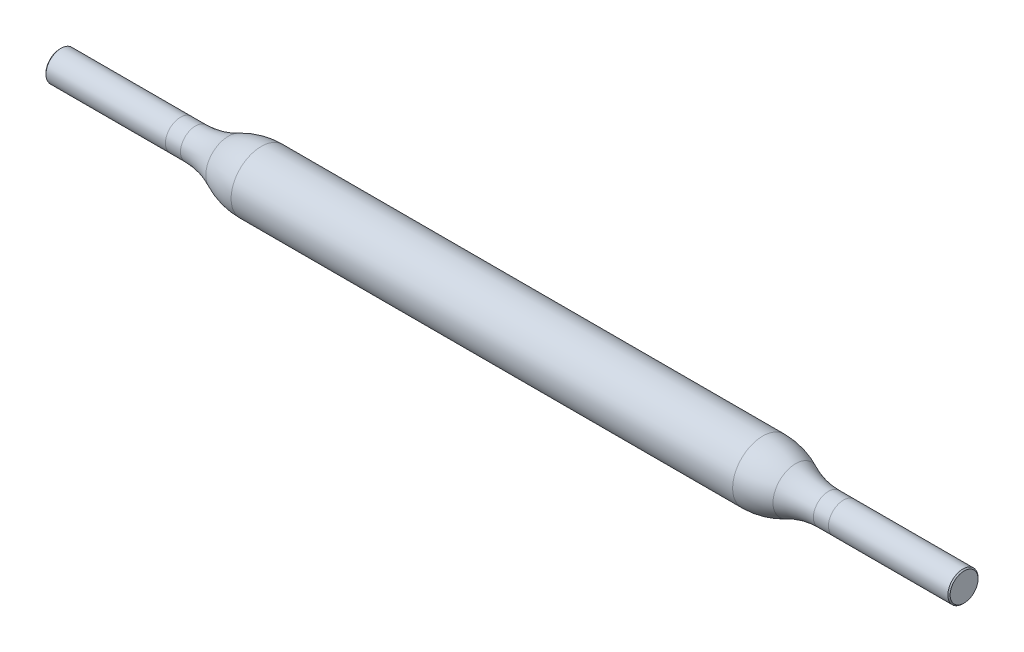
from build123d import *

# Parameters (mm, degrees)
CHAMFER1_SIZE = 0.075


with BuildPart() as part:
    # Sketch1 → Revolve2 (revolve)
    with BuildSketch(Plane.XY, mode=Mode.PRIVATE) as revolve2_sk:
        with BuildLine():
            Line((-30, 0), (30, 0))
            Line((30, 0), (30, 1))
            Line((30, 1), (21, 1))
            ThreePointArc((21, 1), (19.881966011, 1.126602828), (18.820550528, 1.5))
            ThreePointArc((18.820550528, 1.5), (17.759135045, 1.873397172), (16.641101056, 2))
            Line((16.641101056, 2), (-16.641101056, 2))
            ThreePointArc((-16.641101056, 2), (-17.759135045, 1.873397172), (-18.820550528, 1.5))
            ThreePointArc((-18.820550528, 1.5), (-19.881966011, 1.126602828), (-21, 1))
            Line((-21, 1), (-30, 1))
            Line((-30, 1), (-30, 0))
        make_face()
    revolve(revolve2_sk.sketch.rotate(Axis((-30, 0, 0), (1, 0, 0)), 90), axis=Axis((-30, 0, 0), (1, 0, 0)))

    # Chamfer1
    chamfer1_edges = [part.edges().sort_by_distance(p)[0] for p in [
        (30, 0, -1),
        (-30, 0, -1),
    ]]
    chamfer(chamfer1_edges, length=CHAMFER1_SIZE)


solid = part.part
